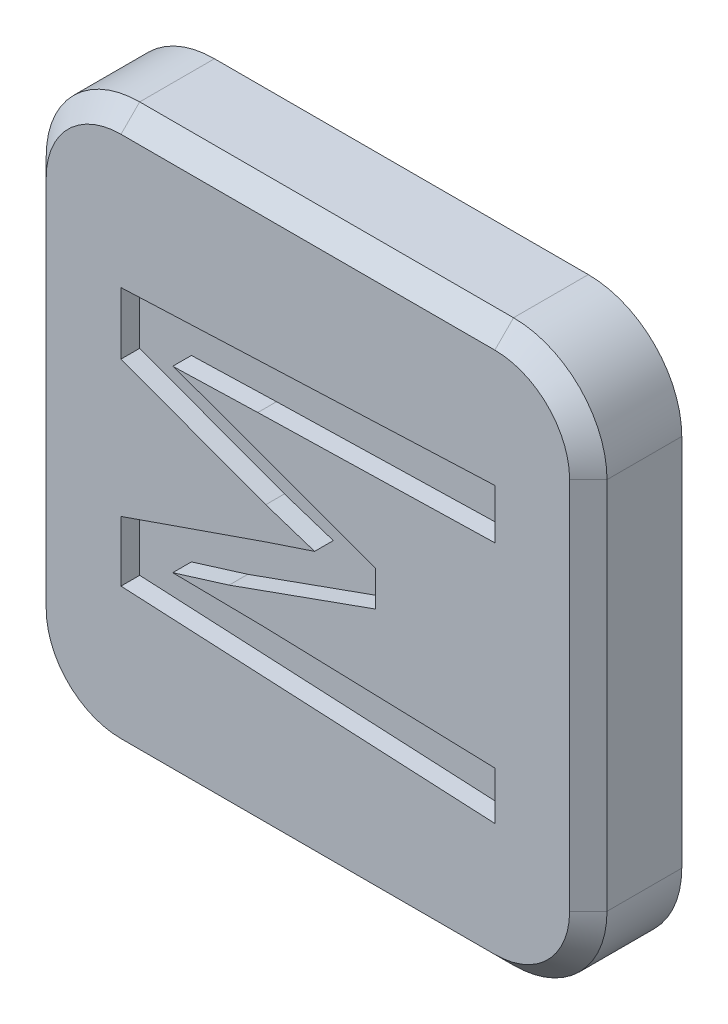
from build123d import *

# Parameters (mm, degrees)
SKETCH1_W             = 30
SKETCH1_H             = 30
BOSS_EXTRUDE1_DEPTH   = 5
SKETCH1_3_OUTSIDE_W   = 40.544
SKETCH1_3_OUTSIDE_H   = 40.544
SKETCH1_3_OUTSIDE_W_2 = 30
SKETCH1_3_OUTSIDE_H_2 = 30
CUT_EXTRUDE1_DEPTH    = 1
FILLET1_R             = 5
CHAMFER1_SIZE         = 1


with BuildPart() as part:
    # Sketch1 → Boss-Extrude1 (new body)
    with BuildSketch(Plane(origin=(0, 0, 0), x_dir=(0, 1, 0), z_dir=(0, 0, 1))):
        Rectangle(SKETCH1_W, SKETCH1_H)
    extrude(amount=-BOSS_EXTRUDE1_DEPTH)

    # Sketch1<3> outside → Cut-Extrude1 (cut)
    # profile 1 of 2: a face of its own
    with BuildSketch(Plane(origin=(0, 0, 0), x_dir=(0, 1, 0), z_dir=(0, 0, 1))):
        Rectangle(SKETCH1_3_OUTSIDE_W, SKETCH1_3_OUTSIDE_H)
        Rectangle(SKETCH1_3_OUTSIDE_W_2, SKETCH1_3_OUTSIDE_H_2, mode=Mode.SUBTRACT)
    # profile 2 of 2: a face of its own
    with BuildSketch(Plane(origin=(0, 0, 0), x_dir=(0, 1, 0), z_dir=(0, 0, 1))):
        Polygon((7.730978261, -10), (5.072463768, -10), (4.769021739, 2.68115942), (4.637681159, 7.232789855), (3.691123188, 4.524456522), (0.697463768, -3.623188406), (-1.186594203, -3.623188406), (-3.994565217, 4.216485507), (-4.927536232, 7.232789855), (-4.990942029, 2.463768116), (-5.362318841, -10), (-7.930253623, -10), (-6.933876812, 10), (-3.704710145, 10), (-1.014492754, 2.255434783), (-0.144927536, -0.357789855), (0.711050725, 2.255434783), (3.582427536, 10), (6.897644928, 10), align=None)
    extrude(amount=-CUT_EXTRUDE1_DEPTH, mode=Mode.SUBTRACT)

    # Fillet1
    fillet1_edges = [part.edges().sort_by_distance(p)[0] for p in [
        (15, 15, -2.5),
        (-15, 15, -2.5),
        (-15, -15, -2.5),
        (15, -15, -2.5),
    ]]
    fillet(fillet1_edges, radius=FILLET1_R)

    # Chamfer1
    chamfer1_edges = [part.edges().sort_by_distance(p)[0] for p in [
        (0, 15, 0),
        (15, 0, 0),
        (-15, 0, 0),
        (0, -15, 0),
        (-13.535533906, -13.535533906, 0),
        (13.535533906, -13.535533906, 0),
        (13.535533906, 13.535533906, 0),
        (-13.535533906, 13.535533906, 0),
    ]]
    chamfer(chamfer1_edges, length=CHAMFER1_SIZE)


solid = part.part
